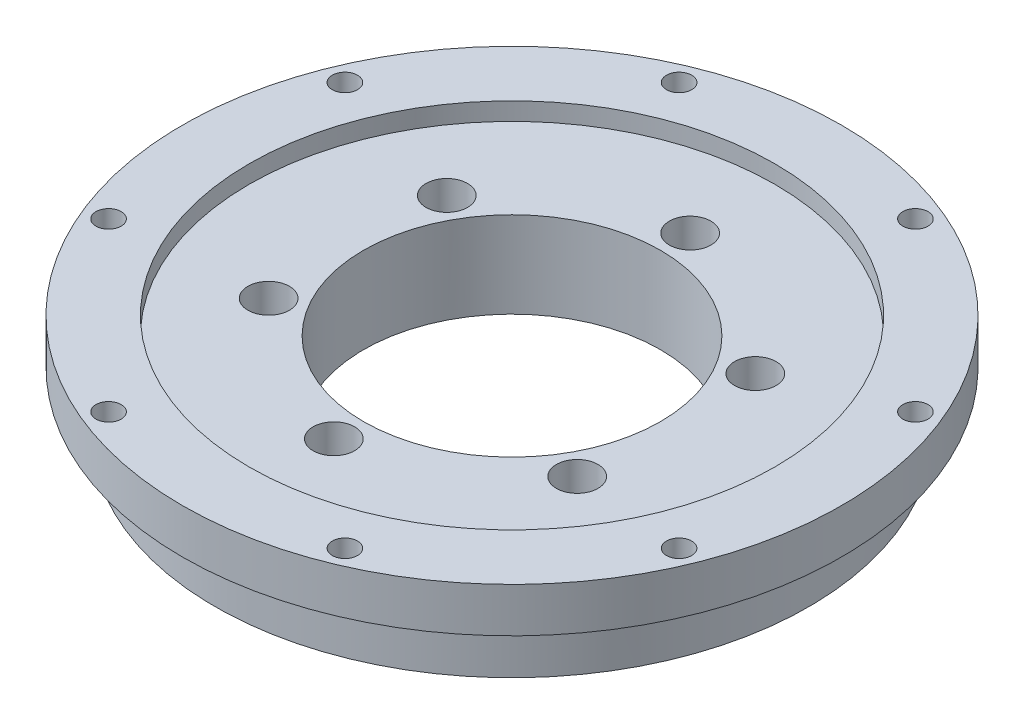
from build123d import *

# Parameters (mm, degrees)
CUT_EXTRUDE1_REACH = 162.832
SKETCH3_R          = 5
SKETCH5_R          = 88.5
CUT_EXTRUDE3_DEPTH = 6
SKETCH4_R          = 7
CUT_EXTRUDE2_DEPTH = 10
CIRPATTERN1_COUNT  = 8


with BuildPart() as part:
    # Sketch1 → Revolve1 (revolve)
    with BuildSketch(Plane.XY, mode=Mode.PRIVATE) as revolve1_sk:
        Polygon((50, 0), (50, 35), (111, 35), (111, 20), (100, 20), (100, 0), align=None)
    revolve(revolve1_sk.sketch.rotate(Axis((0, 0, 0), (0, 1, 0)), 90), axis=Axis((0, 0, 0), (0, 1, 0)))

    # Sketch3 → Cut-Extrude1 (cut, up to next)
    with BuildSketch(Plane.XZ, mode=Mode.PRIVATE) as cut_extrude1_sk1:
        with Locations(Location((0, 60, 0), (0, 0, 270))):
            Circle(SKETCH3_R)
    cut_extrude1_tool1 = extrude(cut_extrude1_sk1.sketch, amount=-CUT_EXTRUDE1_REACH, mode=Mode.PRIVATE) & part.part
    # Sketch3 → Cut-Extrude1 (cut, up to next)
    with BuildSketch(Plane.XZ, mode=Mode.PRIVATE) as cut_extrude1_sk2:
        with Locations(Location((51.961524227, 30, 0), (0, 0, 270))):
            Circle(SKETCH3_R)
    cut_extrude1_tool2 = extrude(cut_extrude1_sk2.sketch, amount=-CUT_EXTRUDE1_REACH, mode=Mode.PRIVATE) & part.part
    # Sketch3 → Cut-Extrude1 (cut, up to next)
    with BuildSketch(Plane.XZ, mode=Mode.PRIVATE) as cut_extrude1_sk3:
        with Locations(Location((51.961524227, -30, 0), (0, 0, 270))):
            Circle(SKETCH3_R)
    cut_extrude1_tool3 = extrude(cut_extrude1_sk3.sketch, amount=-CUT_EXTRUDE1_REACH, mode=Mode.PRIVATE) & part.part
    # Sketch3 → Cut-Extrude1 (cut, up to next)
    with BuildSketch(Plane.XZ, mode=Mode.PRIVATE) as cut_extrude1_sk4:
        with Locations(Location((0, -60, 0), (0, 0, 270))):
            Circle(SKETCH3_R)
    cut_extrude1_tool4 = extrude(cut_extrude1_sk4.sketch, amount=-CUT_EXTRUDE1_REACH, mode=Mode.PRIVATE) & part.part
    # Sketch3 → Cut-Extrude1 (cut, up to next)
    with BuildSketch(Plane.XZ, mode=Mode.PRIVATE) as cut_extrude1_sk5:
        with Locations(Location((-51.961524227, -30, 0), (0, 0, 270))):
            Circle(SKETCH3_R)
    cut_extrude1_tool5 = extrude(cut_extrude1_sk5.sketch, amount=-CUT_EXTRUDE1_REACH, mode=Mode.PRIVATE) & part.part
    # Sketch3 → Cut-Extrude1 (cut, up to next)
    with BuildSketch(Plane.XZ, mode=Mode.PRIVATE) as cut_extrude1_sk6:
        with Locations(Location((-51.961524227, 30, 0), (0, 0, 270))):
            Circle(SKETCH3_R)
    cut_extrude1_tool6 = extrude(cut_extrude1_sk6.sketch, amount=-CUT_EXTRUDE1_REACH, mode=Mode.PRIVATE) & part.part
    add(cut_extrude1_tool1.solids().sort_by_distance((0, 0, 60))[0], mode=Mode.SUBTRACT)
    add(cut_extrude1_tool2.solids().sort_by_distance((51.961524, 0, 30))[0], mode=Mode.SUBTRACT)
    add(cut_extrude1_tool3.solids().sort_by_distance((51.961524, 0, -30))[0], mode=Mode.SUBTRACT)
    add(cut_extrude1_tool4.solids().sort_by_distance((0, 0, -60))[0], mode=Mode.SUBTRACT)
    add(cut_extrude1_tool5.solids().sort_by_distance((-51.961524, 0, -30))[0], mode=Mode.SUBTRACT)
    add(cut_extrude1_tool6.solids().sort_by_distance((-51.961524, 0, 30))[0], mode=Mode.SUBTRACT)

    # Sketch5 → Cut-Extrude3 (cut)
    with BuildSketch(Plane(origin=(0, 35, 0), x_dir=(1, 0, 0), z_dir=(0, 1, 0))):
        with Locations(Location((0, 0, 0), (0, 0, 270))):
            Circle(SKETCH5_R)
    extrude(amount=-CUT_EXTRUDE3_DEPTH, mode=Mode.SUBTRACT)

    # Sketch4 → Cut-Extrude2 (cut)
    with BuildSketch(Plane(origin=(0, 29, 0), x_dir=(1, 0, 0), z_dir=(0, 1, 0))):
        with Locations(Location((0, 60, 0), (0, 0, 270))):
            Circle(SKETCH4_R)
        with Locations(Location((51.961524227, 30, 0), (0, 0, 270))):
            Circle(SKETCH4_R)
        with Locations(Location((51.961524227, -30, 0), (0, 0, 270))):
            Circle(SKETCH4_R)
        with Locations(Location((0, -60, 0), (0, 0, 270))):
            Circle(SKETCH4_R)
        with Locations(Location((-51.961524227, -30, 0), (0, 0, 270))):
            Circle(SKETCH4_R)
        with Locations(Location((-51.961524227, 30, 0), (0, 0, 270))):
            Circle(SKETCH4_R)
    extrude(amount=-CUT_EXTRUDE2_DEPTH, mode=Mode.SUBTRACT)

    # Sketch8 → M10 Tapped Hole1 (revolve, cut)
    with BuildSketch(Plane(origin=(39.799076966, 20, 96.083471381), x_dir=(0, 0, -1), z_dir=(1, 0, 0))):
        Polygon((0, 0), (0, 27.053657631), (4.25, 24.5), (4.25, 0.775), (5.025, 0), align=None)
    m10_tapped_hole1 = revolve(axis=Axis((39.799076966, 13.65, 96.083471381), (0, 1, 0)), mode=Mode.SUBTRACT)

    # CirPattern1: M10 Tapped Hole1 ×8 about axis
    cirpattern1_axis = Axis((0, 0, 0), (0, 1, 0))
    for i in range(1, CIRPATTERN1_COUNT):
        add(m10_tapped_hole1.rotate(cirpattern1_axis, i * 360 / CIRPATTERN1_COUNT), mode=Mode.SUBTRACT)


solid = part.part
